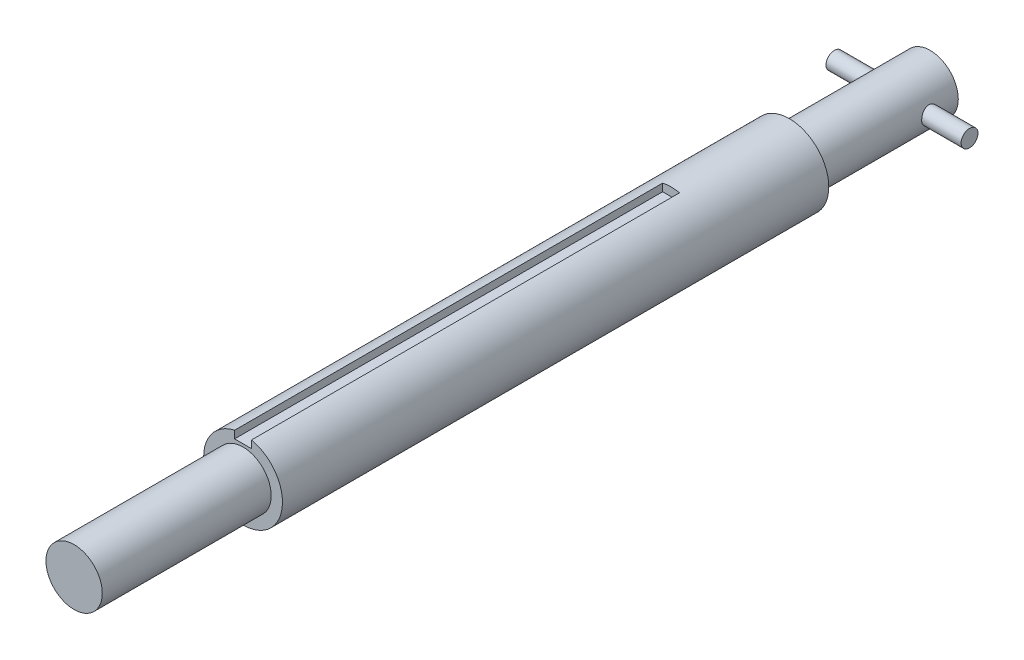
from build123d import *

# Parameters (mm, degrees)
SKETCH1_R                = 5
BOSS_EXTRUDE1_DEPTH      = 25
SKETCH2_R                = 7
BOSS_EXTRUDE2_DEPTH      = 97
SKETCH3_R                = 5
BOSS_EXTRUDE3_DEPTH      = 30
CUT_EXTRUDE1_START       = 7
SKETCH4_W                = 3
SKETCH4_H                = 76
CUT_EXTRUDE1_DEPTH       = 1.5
CUT_EXTRUDE2_DEPTH       = 153.322027297
CUT_EXTRUDE2_DEPTH_BACK  = 153.322027297
SKETCH5_R                = 1.5
BOSS_EXTRUDE4_DEPTH      = 12
BOSS_EXTRUDE4_DEPTH_BACK = 12
SKETCH6_R                = 1.5


with BuildPart() as part:
    # Sketch1 → Boss-Extrude1 (new body)
    with BuildSketch(Plane.XY):
        Circle(SKETCH1_R)
    extrude(amount=BOSS_EXTRUDE1_DEPTH)

    # Sketch2 → Boss-Extrude2 (add)
    with BuildSketch(Plane.XY.offset(25)):
        with Locations(Location((0, 0, 0), (0, 0, 180))):
            Circle(SKETCH2_R)
    extrude(amount=BOSS_EXTRUDE2_DEPTH)

    # Sketch3 → Boss-Extrude3 (add)
    with BuildSketch(Plane.XY.offset(122)):
        Circle(SKETCH3_R)
    extrude(amount=BOSS_EXTRUDE3_DEPTH)

    # Sketch4 → Cut-Extrude1 (cut)
    with BuildSketch(Plane(origin=(0, 0, 0), x_dir=(1, 0, 0), z_dir=(0, 1, 0)).offset(CUT_EXTRUDE1_START)):
        with Locations((0, -84)):
            Rectangle(SKETCH4_W, SKETCH4_H)
    extrude(amount=-CUT_EXTRUDE1_DEPTH, mode=Mode.SUBTRACT)

    # Sketch5 → Cut-Extrude2 (cut, two sides: drawn at the far end of the back side and taken through both)
    with BuildSketch(Plane(origin=(0, 0, 0), x_dir=(0, 0, -1), z_dir=(1, 0, 0)).offset(-CUT_EXTRUDE2_DEPTH_BACK)):
        with Locations(Location((-5, 0, 0), (0, 0, 179.999999999))):
            Circle(SKETCH5_R)
    extrude(amount=CUT_EXTRUDE2_DEPTH + CUT_EXTRUDE2_DEPTH_BACK, mode=Mode.SUBTRACT)


with BuildPart() as body_2:
    # Sketch6 → Boss-Extrude4 (new, two sides: drawn at the far end of the back side and taken through both)
    with BuildSketch(Plane(origin=(0, 0, 0), x_dir=(0, 0, -1), z_dir=(1, 0, 0)).offset(-BOSS_EXTRUDE4_DEPTH_BACK)):
        with Locations((-5, 0)):
            Circle(SKETCH6_R)
    extrude(amount=BOSS_EXTRUDE4_DEPTH + BOSS_EXTRUDE4_DEPTH_BACK)


solid = Compound([part.part, body_2.part])
